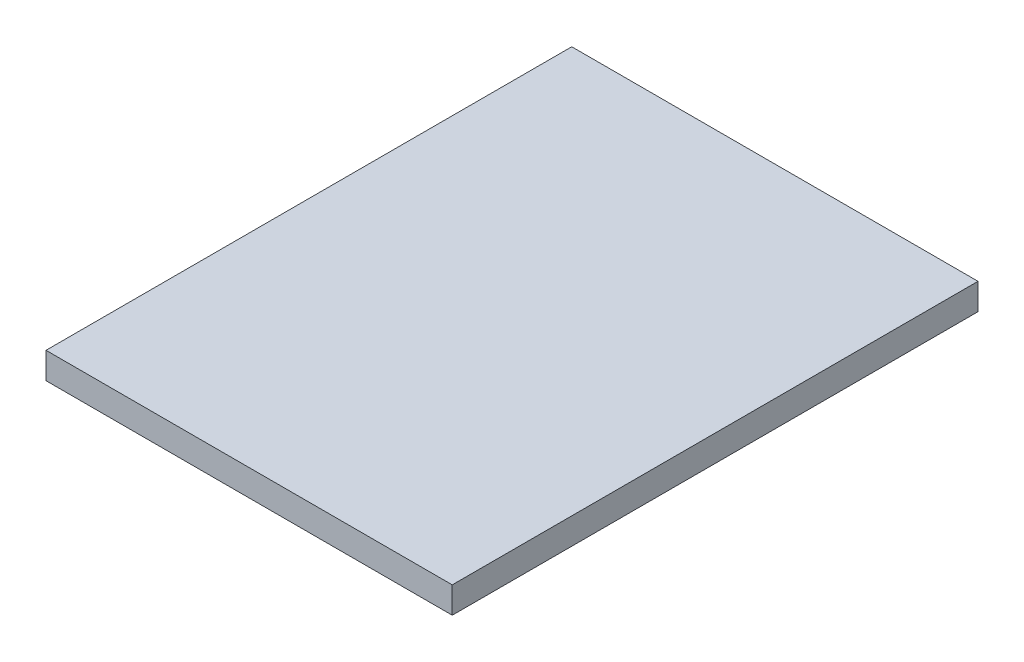
from build123d import *

# Parameters (mm, degrees)
SKETCH1_W              = 617
SKETCH1_H              = 40
TOPPING_PU_ALT_1_DEPTH = 798.5


with BuildPart() as part:
    # Sketch1 → TOPPING_pu_alt_1 (new body)
    with BuildSketch(Plane.XY):
        with Locations((350, 221.5)):
            Rectangle(SKETCH1_W, SKETCH1_H)
    extrude(amount=-TOPPING_PU_ALT_1_DEPTH)


solid = part.part
